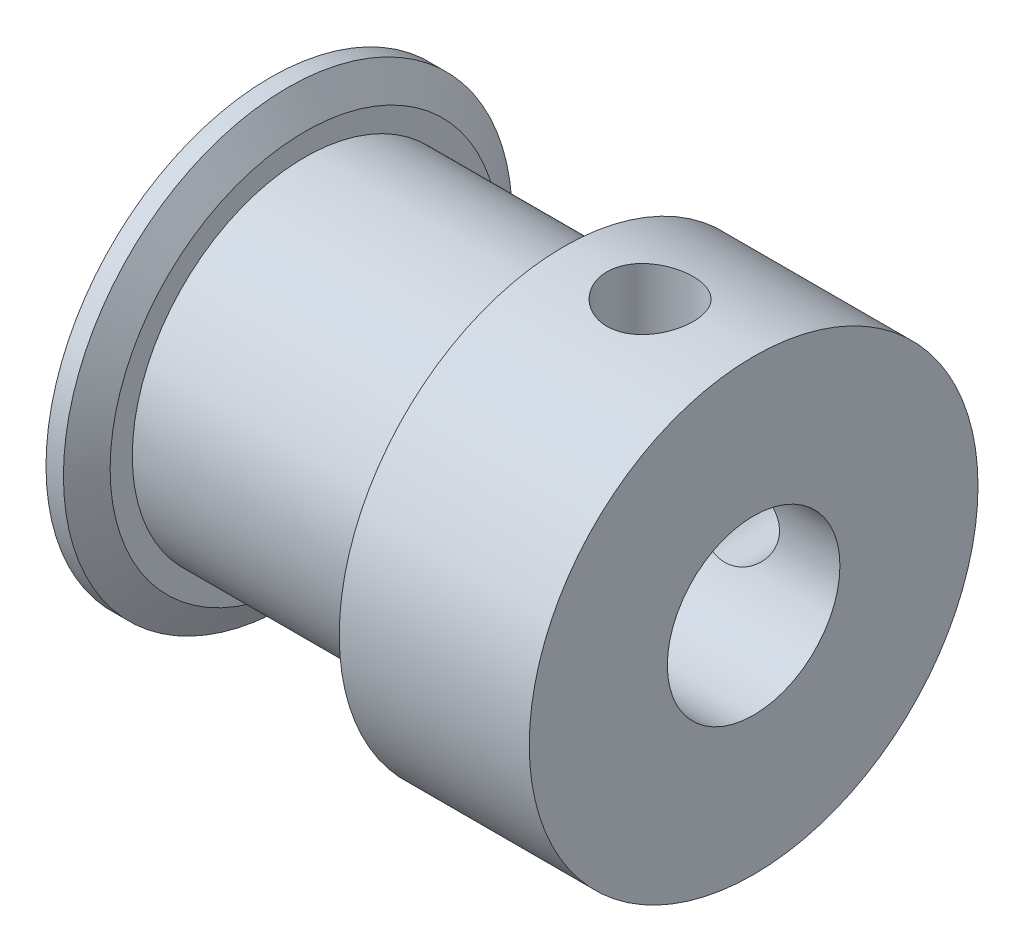
from build123d import *

# Parameters (mm, degrees)
HOLE_WIZARD_M3_1_REACH   = 22.18
HOLE_WIZARD_M3_1_BORE_R  = 1.25
PATTERN_CIRCULAR_1_COUNT = 2
PATTERN_CIRCULAR_1_ANGLE = 90


with BuildPart() as part:
    # 草图1 → 旋转1 (revolve)
    with BuildSketch(Plane(origin=(0, 0, 0), x_dir=(1, 0, 0), z_dir=(0, 1, 0)), mode=Mode.PRIVATE) as revolve_1_sk:
        Polygon((14, 6.5), (14, 2.5), (0, 2.5), (0, 6.5), (0.504674566, 6.5), (1, 5.642071182), (1, 5), (8, 5), (8, 5.642071182), (8.495325434, 6.5), align=None)
    revolve(revolve_1_sk.sketch.rotate(Axis((-10.793334546, 0, 0), (1, 0, 0)), 180), axis=Axis((-10.793334546, 0, 0), (1, 0, 0)))

    # M3 螺纹孔1 bore → M3 螺纹孔1 (cut, up to next)
    with BuildSketch(Plane(origin=(0, 6.5, 0), x_dir=(1, 0, 0), z_dir=(0, 1, 0)), mode=Mode.PRIVATE) as hole_wizard_m3_1_sk1:
        with Locations((11, 0)):
            Circle(HOLE_WIZARD_M3_1_BORE_R)
    hole_wizard_m3_1_tool1 = extrude(hole_wizard_m3_1_sk1.sketch, amount=-HOLE_WIZARD_M3_1_REACH, mode=Mode.PRIVATE) & part.part
    hole_wizard_m3_1 = hole_wizard_m3_1_tool1.solids().sort_by_distance((11, 6.5, 0))[0]
    add(hole_wizard_m3_1, mode=Mode.SUBTRACT)

    # 阵列(圆周)1: M3 螺纹孔1 ×2 about axis
    pattern_circular_1_axis = Axis((-10.793334546, 0, 0), (-1, 0, 0))
    for i in range(1, PATTERN_CIRCULAR_1_COUNT):
        add(hole_wizard_m3_1.rotate(pattern_circular_1_axis, i * PATTERN_CIRCULAR_1_ANGLE / (PATTERN_CIRCULAR_1_COUNT - 1)), mode=Mode.SUBTRACT)


solid = part.part
